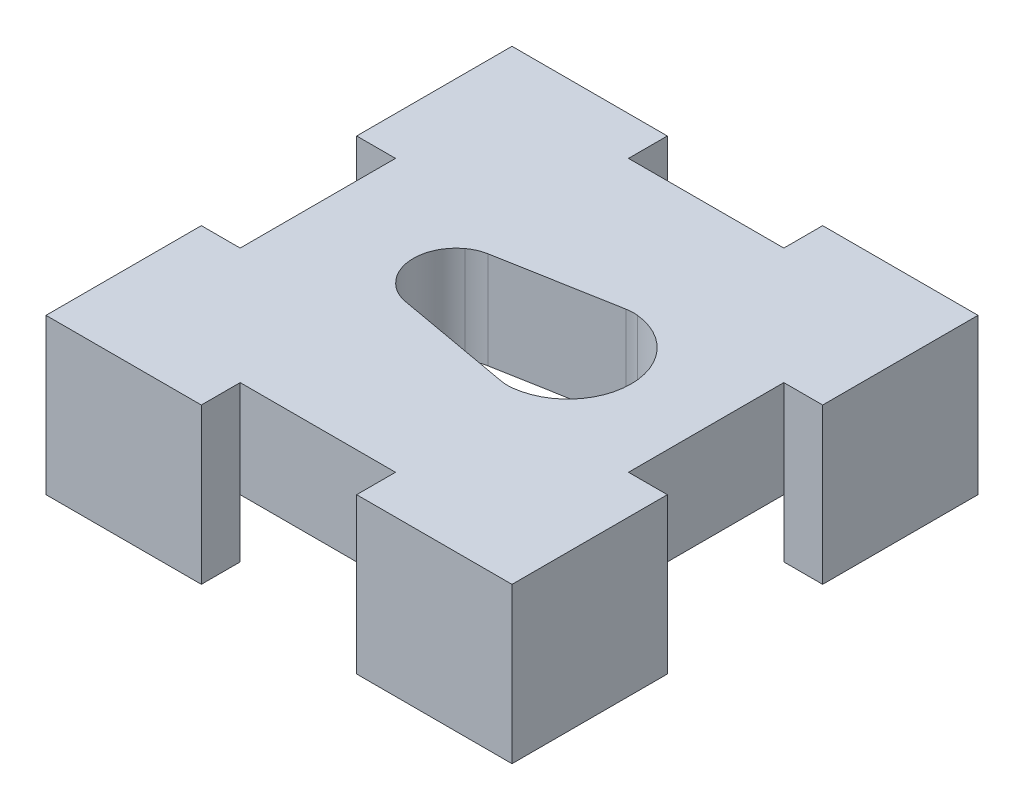
from build123d import *

# Parameters (mm, degrees)
SKETCH1_W           = 10
SKETCH1_H           = 10
BOSS_EXTRUDE1_DEPTH = 2.5
BOSS_EXTRUDE2_DEPTH = 2.5
BOSS_EXTRUDE3_DEPTH = 1.5


with BuildPart() as part:
    # Sketch1 → Boss-Extrude1 (new body)
    with BuildSketch(Plane(origin=(0, 0, 0), x_dir=(1, 0, 0), z_dir=(0, 1, 0))):
        Rectangle(SKETCH1_W, SKETCH1_H)
        with BuildLine():
            ThreePointArc((-2.092605578, 0.886322491), (-1.895132853, 0.999347796), (-1.677221968, 1.064808042))
            Line((-1.677221968, 1.064808042), (1.331431871, 1.605489361))
            ThreePointArc((1.331431871, 1.605489361), (1.474163525, 1.620673027), (1.617598637, 1.615265837))
            ThreePointArc((1.617598637, 1.615265837), (3.065, 0), (1.617598637, -1.615265837))
            ThreePointArc((1.617598637, -1.615265837), (1.474163525, -1.620673027), (1.331431871, -1.605489361))
            Line((1.331431871, -1.605489361), (-1.677221968, -1.064808042))
            ThreePointArc((-1.677221968, -1.064808042), (-1.895132853, -0.999347796), (-2.092605578, -0.886322491))
            ThreePointArc((-2.092605578, -0.886322491), (-2.54112078, 0), (-2.092605578, 0.886322491))
        make_face(mode=Mode.SUBTRACT)
    extrude(amount=BOSS_EXTRUDE1_DEPTH)

    # Sketch2 → Boss-Extrude2 (add)
    with BuildSketch(Plane(origin=(0, 0, 0), x_dir=(1, 0, 0), z_dir=(0, 1, 0))):
        Polygon((-2, 6), (-6, 6), (-6, 2), (-5, 2), (-5, 5), (-2, 5), align=None)
        Polygon((2, 6), (2, 5), (5, 5), (5, 2), (6, 2), (6, 6), align=None)
        Polygon((5, -2), (5, -5), (2, -5), (2, -6), (6, -6), (6, -2), align=None)
        Polygon((-6, -2), (-5, -2), (-5, -5), (-2, -5), (-2, -6), (-6, -6), align=None)
    extrude(amount=BOSS_EXTRUDE2_DEPTH)

    # Sketch2<4> → Boss-Extrude3 (add)
    with BuildSketch(Plane(origin=(0, 0, 0), x_dir=(1, 0, 0), z_dir=(0, 1, 0))):
        Polygon((-2, 6), (-6, 6), (-6, 2), (-5, 2), (-5, 5), (-2, 5), align=None)
        Polygon((2, 6), (2, 5), (5, 5), (5, 2), (6, 2), (6, 6), align=None)
        Polygon((5, -2), (5, -5), (2, -5), (2, -6), (6, -6), (6, -2), align=None)
        Polygon((-6, -2), (-5, -2), (-5, -5), (-2, -5), (-2, -6), (-6, -6), align=None)
    extrude(amount=-BOSS_EXTRUDE3_DEPTH)


solid = part.part
